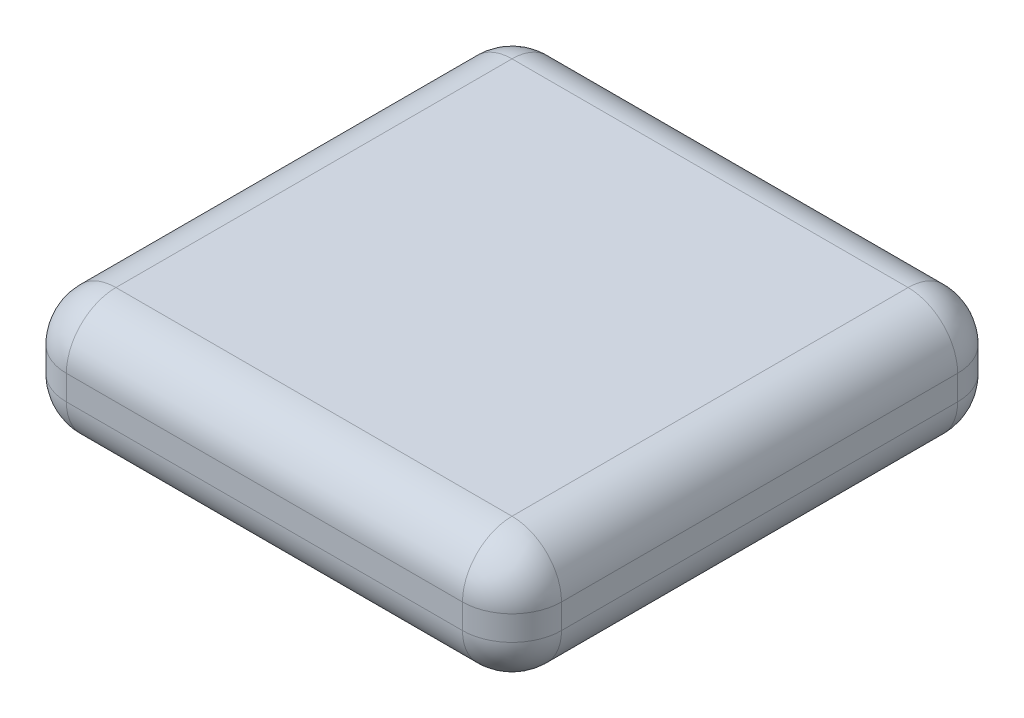
from build123d import *

# Parameters (mm, degrees)
SKIZZE1_W                       = 200
SKIZZE1_H                       = 200
AUFSATZ_LINEAR_AUSTRAGEN1_DEPTH = 50
VERRUNDUNG1_R                   = 20


with BuildPart() as part:
    # Skizze1 → Aufsatz-Linear austragen1 (new body)
    with BuildSketch(Plane(origin=(0, 0, 0), x_dir=(1, 0, 0), z_dir=(0, 1, 0))):
        Rectangle(SKIZZE1_W, SKIZZE1_H)
    extrude(amount=AUFSATZ_LINEAR_AUSTRAGEN1_DEPTH)

    # Verrundung1
    verrundung1_edges = [part.edges().sort_by_distance(p)[0] for p in [
        (-100, 50, 0),
        (0, 50, 100),
        (100, 50, 0),
        (0, 0, 100),
        (-100, 0, 0),
        (0, 0, -100),
        (100, 0, 0),
        (100, 25, 100),
        (-100, 25, 100),
        (-100, 25, -100),
        (100, 25, -100),
        (0, 50, -100),
    ]]
    fillet(verrundung1_edges, radius=VERRUNDUNG1_R)


solid = part.part
